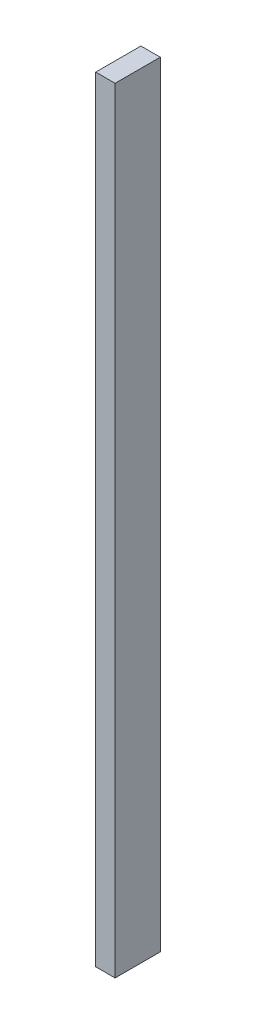
from build123d import *

# Parameters (mm, degrees)
SKETCH1_W           = 38.1
SKETCH1_H           = 88.9
BOSS_EXTRUDE1_DEPTH = 762


with BuildPart() as part:
    # Sketch1 → Boss-Extrude1 (new, symmetric)
    with BuildSketch(Plane(origin=(0, 0, 0), x_dir=(1, 0, 0), z_dir=(0, 1, 0))):
        Rectangle(SKETCH1_W, SKETCH1_H)
    extrude(amount=BOSS_EXTRUDE1_DEPTH, both=True)


solid = part.part
